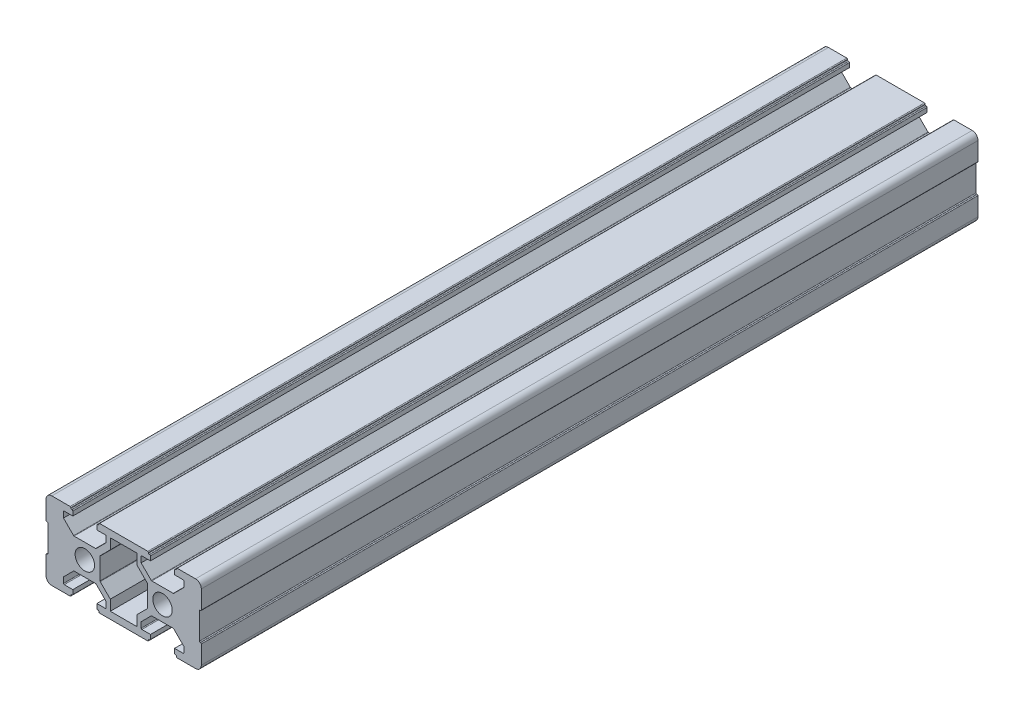
from build123d import *

# Parameters (mm, degrees)
BOSS_EXTRUDE1_DEPTH = 200
SKETCH2_R           = 2.5
CUT_EXTRUDE1_DEPTH  = 203.484567313
SKETCH3_R           = 1.5
CUT_EXTRUDE2_DEPTH  = 42
SKETCH4_R           = 1.5
CUT_EXTRUDE3_DEPTH  = 22


with BuildPart() as part:
    # Sketch1 → Boss-Extrude1 (new body)
    with BuildSketch(Plane.XY):
        with BuildLine():
            Line((-8.5, 10), (-3.8, 10))
            ThreePointArc((-3.8, 10), (-3.658578644, 9.941421356), (-3.6, 9.8))
            Line((-3.6, 9.8), (-3.6, 9.7))
            ThreePointArc((-3.6, 9.7), (-3.541421356, 9.558578644), (-3.4, 9.5))
            Line((-3.4, 9.5), (-3.3, 9.5))
            ThreePointArc((-3.3, 9.5), (-3.158578644, 9.441421356), (-3.1, 9.3))
            Line((-3.1, 9.3), (-3.1, 8.2))
            Line((-3.1, 8.2), (-5.3, 8.2))
            ThreePointArc((-5.3, 8.2), (-5.441421356, 8.141421356), (-5.5, 8))
            Line((-5.5, 8), (-5.5, 6.560660172))
            Line((-5.5, 6.560660172), (-2.897918472, 3.958578644))
            ThreePointArc((-2.897918472, 3.958578644), (-2.833033802, 3.915224093), (-2.756497116, 3.9))
            Line((-2.756497116, 3.9), (2.756497116, 3.9))
            ThreePointArc((2.756497116, 3.9), (2.833033802, 3.915224093), (2.897918472, 3.958578644))
            Line((2.897918472, 3.958578644), (5.5, 6.560660172))
            Line((5.5, 6.560660172), (5.5, 8))
            ThreePointArc((5.5, 8), (5.441421356, 8.141421356), (5.3, 8.2))
            Line((5.3, 8.2), (3.1, 8.2))
            Line((3.1, 8.2), (3.1, 9.3))
            ThreePointArc((3.1, 9.3), (3.158578644, 9.441421356), (3.3, 9.5))
            Line((3.3, 9.5), (3.4, 9.5))
            ThreePointArc((3.4, 9.5), (3.541421356, 9.558578644), (3.6, 9.7))
            Line((3.6, 9.7), (3.6, 9.8))
            ThreePointArc((3.6, 9.8), (3.658578644, 9.941421356), (3.8, 10))
            Line((3.8, 10), (8.5, 10))
            Line((8.5, 10), (11.5, 10))
            Line((11.5, 10), (16.2, 10))
            ThreePointArc((16.2, 10), (16.341421356, 9.941421356), (16.4, 9.8))
            Line((16.4, 9.8), (16.4, 9.7))
            ThreePointArc((16.4, 9.7), (16.458578644, 9.558578644), (16.6, 9.5))
            Line((16.6, 9.5), (16.7, 9.5))
            ThreePointArc((16.7, 9.5), (16.841421356, 9.441421356), (16.9, 9.3))
            Line((16.9, 9.3), (16.9, 8.2))
            Line((16.9, 8.2), (14.7, 8.2))
            ThreePointArc((14.7, 8.2), (14.558578644, 8.141421356), (14.5, 8))
            Line((14.5, 8), (14.5, 6.560660172))
            Line((14.5, 6.560660172), (17.102081528, 3.958578644))
            ThreePointArc((17.102081528, 3.958578644), (17.166966198, 3.915224093), (17.243502884, 3.9))
            Line((17.243502884, 3.9), (22.756497116, 3.9))
            ThreePointArc((22.756497116, 3.9), (22.833033802, 3.915224093), (22.897918472, 3.958578644))
            Line((22.897918472, 3.958578644), (25.5, 6.560660172))
            Line((25.5, 6.560660172), (25.5, 8))
            ThreePointArc((25.5, 8), (25.441421356, 8.141421356), (25.3, 8.2))
            Line((25.3, 8.2), (23.1, 8.2))
            Line((23.1, 8.2), (23.1, 9.3))
            ThreePointArc((23.1, 9.3), (23.158578644, 9.441421356), (23.3, 9.5))
            Line((23.3, 9.5), (23.4, 9.5))
            ThreePointArc((23.4, 9.5), (23.541421356, 9.558578644), (23.6, 9.7))
            Line((23.6, 9.7), (23.6, 9.8))
            ThreePointArc((23.6, 9.8), (23.658578644, 9.941421356), (23.8, 10))
            Line((23.8, 10), (28.5, 10))
            ThreePointArc((28.5, 10), (29.560660172, 9.560660172), (30, 8.5))
            Line((30, 8.5), (30, 3.8))
            ThreePointArc((30, 3.8), (29.941421356, 3.658578644), (29.8, 3.6))
            Line((29.8, 3.6), (29.7, 3.6))
            ThreePointArc((29.7, 3.6), (29.558578644, 3.541421356), (29.5, 3.4))
            Line((29.5, 3.4), (29.5, 3.3))
            Line((29.5, 3.3), (29.5, -3.3))
            Line((29.5, -3.3), (29.5, -3.4))
            ThreePointArc((29.5, -3.4), (29.558578644, -3.541421356), (29.7, -3.6))
            Line((29.7, -3.6), (29.8, -3.6))
            ThreePointArc((29.8, -3.6), (29.941421356, -3.658578644), (30, -3.8))
            Line((30, -3.8), (30, -8.5))
            ThreePointArc((30, -8.5), (29.560660172, -9.560660172), (28.5, -10))
            Line((28.5, -10), (23.8, -10))
            ThreePointArc((23.8, -10), (23.658578644, -9.941421356), (23.6, -9.8))
            Line((23.6, -9.8), (23.6, -9.7))
            ThreePointArc((23.6, -9.7), (23.541421356, -9.558578644), (23.4, -9.5))
            Line((23.4, -9.5), (23.3, -9.5))
            ThreePointArc((23.3, -9.5), (23.158578644, -9.441421356), (23.1, -9.3))
            Line((23.1, -9.3), (23.1, -8.2))
            Line((23.1, -8.2), (25.3, -8.2))
            ThreePointArc((25.3, -8.2), (25.441421356, -8.141421356), (25.5, -8))
            Line((25.5, -8), (25.5, -6.560660172))
            Line((25.5, -6.560660172), (22.897918472, -3.958578644))
            ThreePointArc((22.897918472, -3.958578644), (22.833033802, -3.915224093), (22.756497116, -3.9))
            Line((22.756497116, -3.9), (17.243502884, -3.9))
            ThreePointArc((17.243502884, -3.9), (17.166966198, -3.915224093), (17.102081528, -3.958578644))
            Line((17.102081528, -3.958578644), (14.5, -6.560660172))
            Line((14.5, -6.560660172), (14.5, -8))
            ThreePointArc((14.5, -8), (14.558578644, -8.141421356), (14.7, -8.2))
            Line((14.7, -8.2), (16.9, -8.2))
            Line((16.9, -8.2), (16.9, -9.3))
            ThreePointArc((16.9, -9.3), (16.841421356, -9.441421356), (16.7, -9.5))
            Line((16.7, -9.5), (16.6, -9.5))
            ThreePointArc((16.6, -9.5), (16.458578644, -9.558578644), (16.4, -9.7))
            Line((16.4, -9.7), (16.4, -9.8))
            ThreePointArc((16.4, -9.8), (16.341421356, -9.941421356), (16.2, -10))
            Line((16.2, -10), (11.5, -10))
            Line((11.5, -10), (8.5, -10))
            Line((8.5, -10), (3.8, -10))
            ThreePointArc((3.8, -10), (3.658578644, -9.941421356), (3.6, -9.8))
            Line((3.6, -9.8), (3.6, -9.7))
            ThreePointArc((3.6, -9.7), (3.541421356, -9.558578644), (3.4, -9.5))
            Line((3.4, -9.5), (3.3, -9.5))
            ThreePointArc((3.3, -9.5), (3.158578644, -9.441421356), (3.1, -9.3))
            Line((3.1, -9.3), (3.1, -8.2))
            Line((3.1, -8.2), (5.3, -8.2))
            ThreePointArc((5.3, -8.2), (5.441421356, -8.141421356), (5.5, -8))
            Line((5.5, -8), (5.5, -6.560660172))
            Line((5.5, -6.560660172), (2.897918472, -3.958578644))
            ThreePointArc((2.897918472, -3.958578644), (2.833033802, -3.915224093), (2.756497116, -3.9))
            Line((2.756497116, -3.9), (-2.756497116, -3.9))
            ThreePointArc((-2.756497116, -3.9), (-2.833033802, -3.915224093), (-2.897918472, -3.958578644))
            Line((-2.897918472, -3.958578644), (-5.5, -6.560660172))
            Line((-5.5, -6.560660172), (-5.5, -8))
            ThreePointArc((-5.5, -8), (-5.441421356, -8.141421356), (-5.3, -8.2))
            Line((-5.3, -8.2), (-3.1, -8.2))
            Line((-3.1, -8.2), (-3.1, -9.3))
            ThreePointArc((-3.1, -9.3), (-3.158578644, -9.441421356), (-3.3, -9.5))
            Line((-3.3, -9.5), (-3.4, -9.5))
            ThreePointArc((-3.4, -9.5), (-3.541421356, -9.558578644), (-3.6, -9.7))
            Line((-3.6, -9.7), (-3.6, -9.8))
            ThreePointArc((-3.6, -9.8), (-3.658578644, -9.941421356), (-3.8, -10))
            Line((-3.8, -10), (-8.5, -10))
            ThreePointArc((-8.5, -10), (-9.560660172, -9.560660172), (-10, -8.5))
            Line((-10, -8.5), (-10, -3.8))
            ThreePointArc((-10, -3.8), (-9.941421356, -3.658578644), (-9.8, -3.6))
            Line((-9.8, -3.6), (-9.7, -3.6))
            ThreePointArc((-9.7, -3.6), (-9.558578644, -3.541421356), (-9.5, -3.4))
            Line((-9.5, -3.4), (-9.5, -3.3))
            Line((-9.5, -3.3), (-9.5, 3.3))
            Line((-9.5, 3.3), (-9.5, 3.4))
            ThreePointArc((-9.5, 3.4), (-9.558578644, 3.541421356), (-9.7, 3.6))
            Line((-9.7, 3.6), (-9.8, 3.6))
            ThreePointArc((-9.8, 3.6), (-9.941421356, 3.658578644), (-10, 3.8))
            Line((-10, 3.8), (-10, 8.5))
            ThreePointArc((-10, 8.5), (-9.560660172, 9.560660172), (-8.5, 10))
        make_face()
        with BuildLine():
            Line((3.9, 2.756497116), (3.9, -2.756497116))
            ThreePointArc((3.9, -2.756497116), (3.915224093, -2.833033802), (3.958578644, -2.897918472))
            Line((3.958578644, -2.897918472), (6.560660172, -5.5))
            Line((6.560660172, -5.5), (6.560660172, -8.2))
            Line((6.560660172, -8.2), (13.439339828, -8.2))
            Line((13.439339828, -8.2), (13.439339828, -5.5))
            Line((13.439339828, -5.5), (16.041421356, -2.897918472))
            ThreePointArc((16.041421356, -2.897918472), (16.084775907, -2.833033802), (16.1, -2.756497116))
            Line((16.1, -2.756497116), (16.1, 2.756497116))
            ThreePointArc((16.1, 2.756497116), (16.084775907, 2.833033802), (16.041421356, 2.897918472))
            Line((16.041421356, 2.897918472), (13.439339828, 5.5))
            Line((13.439339828, 5.5), (13.439339828, 8.2))
            Line((13.439339828, 8.2), (6.560660172, 8.2))
            Line((6.560660172, 8.2), (6.560660172, 5.5))
            Line((6.560660172, 5.5), (3.958578644, 2.897918472))
            ThreePointArc((3.958578644, 2.897918472), (3.915224093, 2.833033802), (3.9, 2.756497116))
        make_face(mode=Mode.SUBTRACT)
    extrude(amount=BOSS_EXTRUDE1_DEPTH)

    # Sketch2 → Cut-Extrude1 (cut, through all)
    with BuildSketch(Plane.XY.offset(200)):
        Circle(SKETCH2_R)
        with Locations(Location((20, 0, 0), (0, 0, 180))):
            Circle(SKETCH2_R)
    extrude(amount=-CUT_EXTRUDE1_DEPTH, mode=Mode.SUBTRACT)

    # Sketch3 → Cut-Extrude2 (cut)
    with BuildSketch(Plane(origin=(0, -10, 0), x_dir=(-1, 0, 0), z_dir=(0, -1, 0))):
        with Locations(Location((0, -183.3, 0), (0, 0, 180))):
            Circle(SKETCH3_R)
        with Locations(Location((0, -166.6, 0), (0, 0, 180))):
            Circle(SKETCH3_R)
    extrude(amount=-CUT_EXTRUDE2_DEPTH, mode=Mode.SUBTRACT)

    # Sketch4 → Cut-Extrude3 (cut)
    with BuildSketch(Plane(origin=(0, -10, 0), x_dir=(-1, 0, 0), z_dir=(0, -1, 0))):
        with Locations(Location((-20, -166.6, 0), (0, 0, 180))):
            Circle(SKETCH4_R)
        with Locations(Location((-20, -183.3, 0), (0, 0, 180))):
            Circle(SKETCH4_R)
    extrude(amount=-CUT_EXTRUDE3_DEPTH, mode=Mode.SUBTRACT)


solid = part.part
